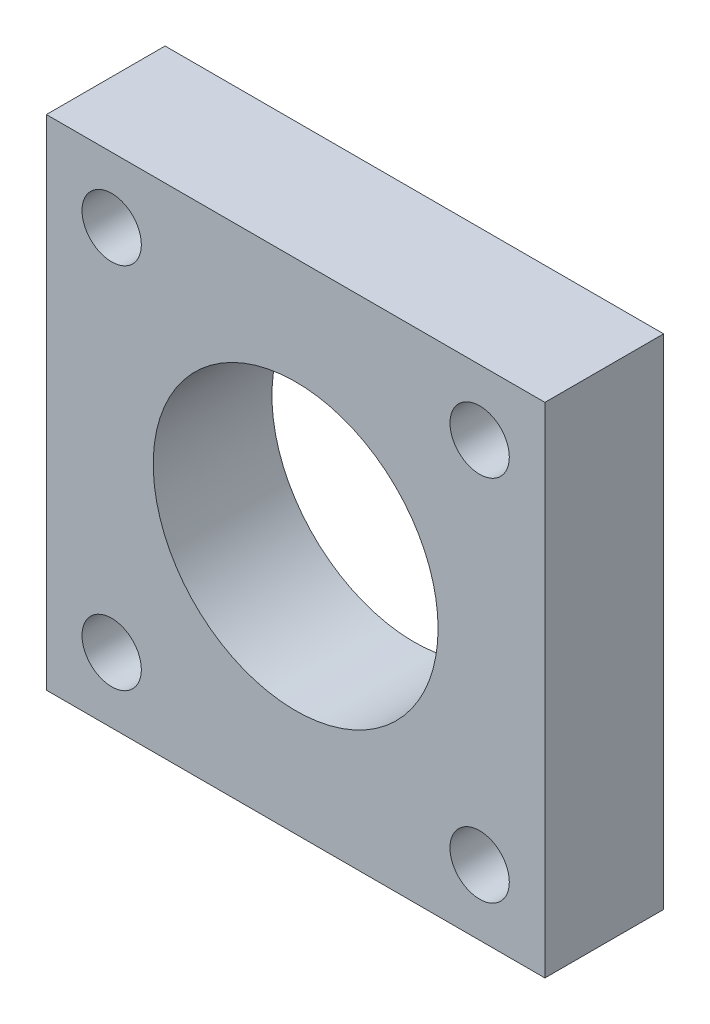
from build123d import *

# Parameters (mm, degrees)
SKIZZE1_W                       = 42
SKIZZE1_H                       = 42
SKIZZE1_R                       = 12
SKIZZE1_R_2                     = 2.5
AUFSATZ_LINEAR_AUSTRAGEN1_DEPTH = 10
SKIZZE2_R                       = 1
SCHNITT_LINEAR_AUSTRAGEN1_DEPTH = 8
M4_GEWINDEBOHRUNG1_D            = 3.3
M4_GEWINDEBOHRUNG1_DEPTH        = 11.5
M4_GEWINDEBOHRUNG1_CSINK_D      = 4.05
M4_GEWINDEBOHRUNG1_CSINK_ANGLE  = 90
M4_GEWINDEBOHRUNG1_TIP          = 0.991420021


with BuildPart() as part:
    # Skizze1 → Aufsatz-Linear austragen1 (new body)
    with BuildSketch(Plane.XY):
        with Locations((-7.301275723, -4.674228082)):
            Rectangle(SKIZZE1_W, SKIZZE1_H)
        with Locations((-7.301275723, -4.674228082)):
            Circle(SKIZZE1_R, mode=Mode.SUBTRACT)
        with Locations((-22.801275723, 10.825771918)):
            Circle(SKIZZE1_R_2, mode=Mode.SUBTRACT)
        with Locations((8.198724277, 10.825771918)):
            Circle(SKIZZE1_R_2, mode=Mode.SUBTRACT)
        with Locations((-22.801275723, -20.174228082)):
            Circle(SKIZZE1_R_2, mode=Mode.SUBTRACT)
        with Locations((8.198724277, -20.174228082)):
            Circle(SKIZZE1_R_2, mode=Mode.SUBTRACT)
    extrude(amount=AUFSATZ_LINEAR_AUSTRAGEN1_DEPTH)

    # Skizze2 → Schnitt-Linear austragen1 (cut)
    with BuildSketch(Plane.ZY.offset(28.301275723)):
        with Locations((4, 4.325771918)):
            Circle(SKIZZE2_R)
        with Locations((4, -13.674228082)):
            Circle(SKIZZE2_R)
    extrude(amount=-SCHNITT_LINEAR_AUSTRAGEN1_DEPTH, mode=Mode.SUBTRACT)

    # M4 Gewindebohrung1
    with Locations(Plane(origin=(-28.301275723, 4.325771918, 4), x_dir=(0, 0, -1), z_dir=(-1, 0, 0))):
        with Locations((0, 0), (0, 18)):
            CounterSinkHole(M4_GEWINDEBOHRUNG1_D / 2, M4_GEWINDEBOHRUNG1_CSINK_D / 2, depth=M4_GEWINDEBOHRUNG1_DEPTH, counter_sink_angle=M4_GEWINDEBOHRUNG1_CSINK_ANGLE)
            with Locations((0, 0, -(M4_GEWINDEBOHRUNG1_DEPTH + M4_GEWINDEBOHRUNG1_TIP / 2))):  # 118° drill point
                Cone(0, M4_GEWINDEBOHRUNG1_D / 2, M4_GEWINDEBOHRUNG1_TIP, mode=Mode.SUBTRACT)


solid = part.part
